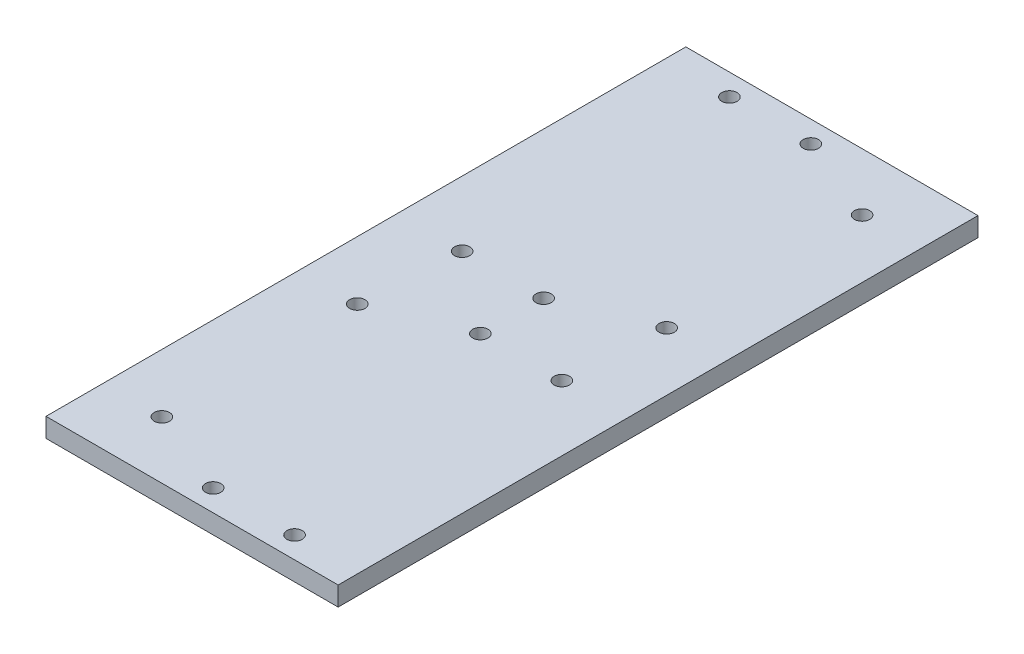
from build123d import *

# Parameters (mm, degrees)
SKETCH_1_W      = 30.5
SKETCH_1_H      = 66.8
SKETCH_1_R      = 0.8
EXTRUDE_1_DEPTH = 2


with BuildPart() as part:
    # 草图1 → 凸台-拉伸1 (new body)
    with BuildSketch(Plane(origin=(0, 0, 0), x_dir=(1, 0, 0), z_dir=(0, 1, 0))):
        with Locations((15.25, -33.4)):
            Rectangle(SKETCH_1_W, SKETCH_1_H)
        with Locations(Location((6.8, -2.25, 0), (0, 0, 270))):
            Circle(SKETCH_1_R, mode=Mode.SUBTRACT)
        with Locations(Location((15.3, -2.25, 0), (0, 0, 270))):
            Circle(SKETCH_1_R, mode=Mode.SUBTRACT)
        with Locations(Location((15.2, -64.55, 0), (0, 0, 270))):
            Circle(SKETCH_1_R, mode=Mode.SUBTRACT)
        with Locations(Location((23.7, -64.55, 0), (0, 0, 270))):
            Circle(SKETCH_1_R, mode=Mode.SUBTRACT)
        with Locations(Location((24.4, -6, 0), (0, 0, 270))):
            Circle(SKETCH_1_R, mode=Mode.SUBTRACT)
        with Locations(Location((24.4, -26.4, 0), (0, 0, 270))):
            Circle(SKETCH_1_R, mode=Mode.SUBTRACT)
        with Locations(Location((6.1, -60.8, 0), (0, 0, 270))):
            Circle(SKETCH_1_R, mode=Mode.SUBTRACT)
        with Locations(Location((6.8, -30.15, 0), (0, 0, 270))):
            Circle(SKETCH_1_R, mode=Mode.SUBTRACT)
        with Locations(Location((6.1, -40.4, 0), (0, 0, 270))):
            Circle(SKETCH_1_R, mode=Mode.SUBTRACT)
        with Locations(Location((23.7, -36.65, 0), (0, 0, 270))):
            Circle(SKETCH_1_R, mode=Mode.SUBTRACT)
        with Locations(Location((15.3, -30.15, 0), (0, 0, 270))):
            Circle(SKETCH_1_R, mode=Mode.SUBTRACT)
        with Locations(Location((15.2, -36.65, 0), (0, 0, 270))):
            Circle(SKETCH_1_R, mode=Mode.SUBTRACT)
    extrude(amount=EXTRUDE_1_DEPTH)


solid = part.part
